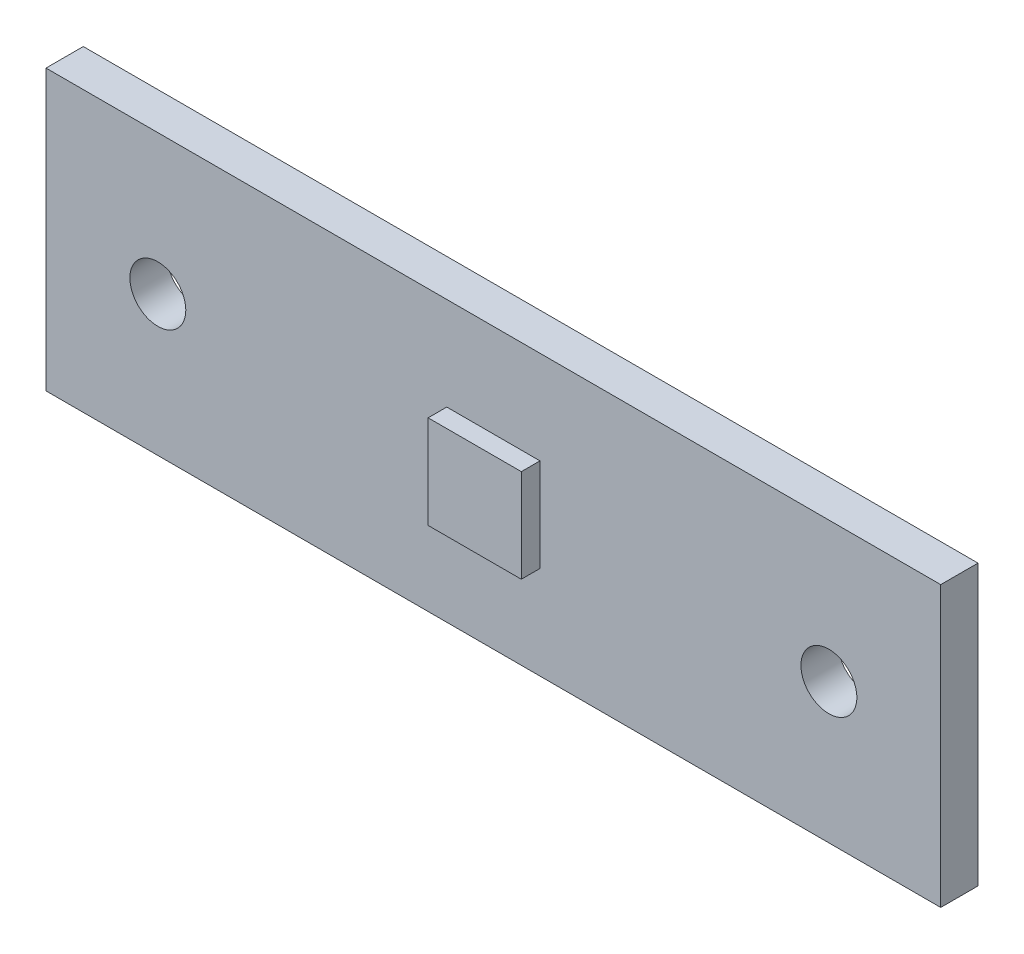
from build123d import *

# Parameters (mm, degrees)
SKETCH1_W           = 48
SKETCH1_H           = 15
SKETCH1_R           = 1.5
BOSS_EXTRUDE1_DEPTH = 2
SKETCH2_W           = 5
SKETCH2_H           = 5
BOSS_EXTRUDE2_DEPTH = 1


with BuildPart() as part:
    # Sketch1 → Boss-Extrude1 (new body)
    with BuildSketch(Plane.XY):
        with Locations((24, 7.5)):
            Rectangle(SKETCH1_W, SKETCH1_H)
        with Locations((6, 7.5)):
            Circle(SKETCH1_R, mode=Mode.SUBTRACT)
        with Locations(Location((42, 7.5, 0), (0, 0, 180))):
            Circle(SKETCH1_R, mode=Mode.SUBTRACT)
    extrude(amount=BOSS_EXTRUDE1_DEPTH)

    # Sketch2 → Boss-Extrude2 (add)
    with BuildSketch(Plane.XY.offset(2)):
        with Locations((24, 7.5)):
            Rectangle(SKETCH2_W, SKETCH2_H)
    extrude(amount=BOSS_EXTRUDE2_DEPTH)


solid = part.part
